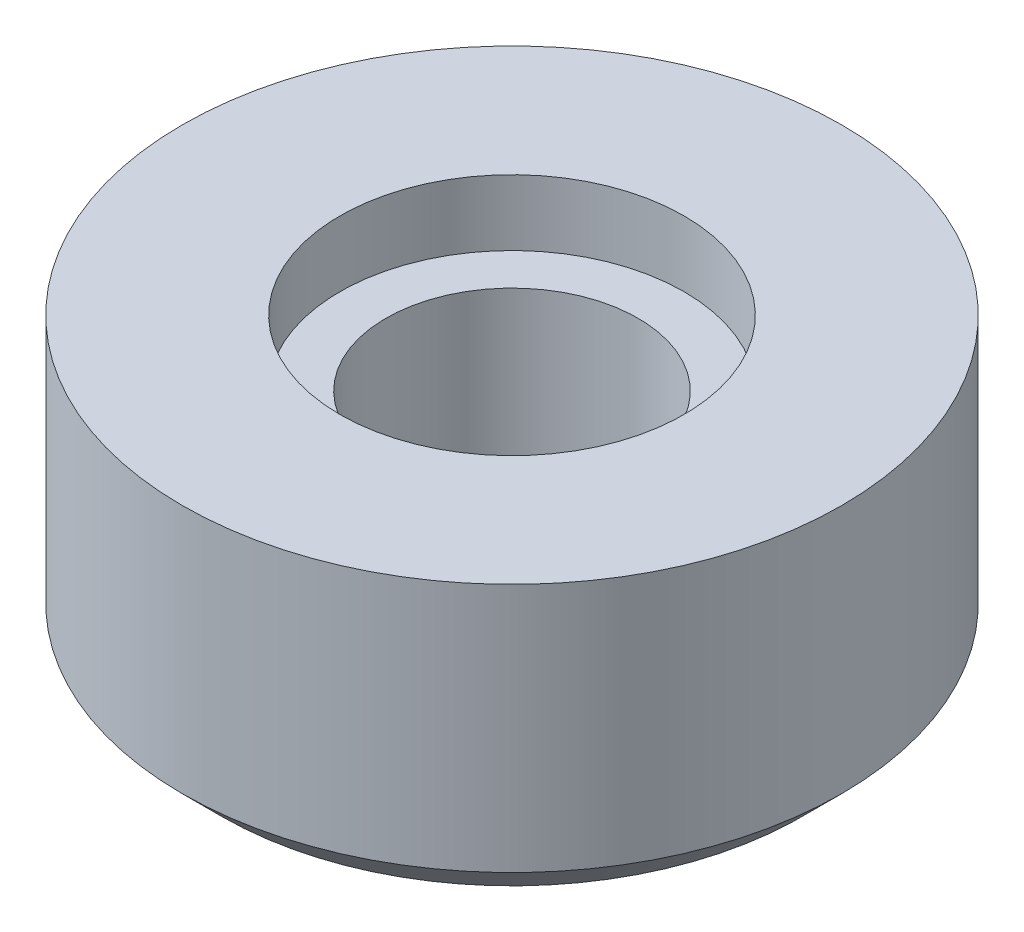
from build123d import *


with BuildPart() as part:
    # Sketch2 → Revolve1 (revolve)
    with BuildSketch(Plane.XY, mode=Mode.PRIVATE) as revolve1_sk:
        Polygon((4.8, 0), (11.05, 0), (12.55, 1.5), (12.55, 11), (6.55, 11), (6.55, 8.5), (4.8, 8.5), align=None)
    revolve(revolve1_sk.sketch.rotate(Axis((0, 14.455038712, 0), (0, -1, 0)), 90), axis=Axis((0, 14.455038712, 0), (0, -1, 0)))


solid = part.part
